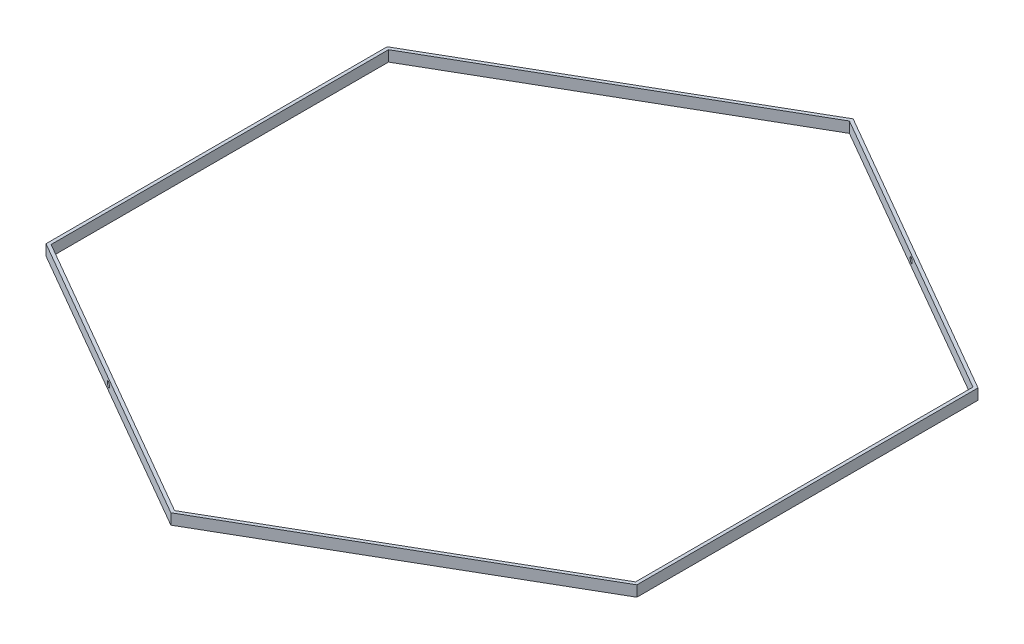
from build123d import *

# Parameters (mm, degrees)
RESSALTO_EXTRUS_O1_DEPTH = 4
ESBO_O2_R                = 1
CORTE_EXTRUS_O1_DEPTH    = 277.856160006


with BuildPart() as part:
    # Esboço1 → Ressalto-extrusão1 (new body)
    with BuildSketch(Plane(origin=(0, 0, 0), x_dir=(1, 0, 0), z_dir=(0, 1, 0))):
        Polygon((110, -63.508529611), (110, 63.508529611), (0, 127.017059222), (-110, 63.508529611), (-110, -63.508529611), (0, -127.017059222), align=None)
        Polygon((108.8, 62.815709288), (0, 125.631418576), (-108.8, 62.815709288), (-108.8, -62.815709288), (0, -125.631418576), (108.8, -62.815709288), align=None, mode=Mode.SUBTRACT)
    extrude(amount=RESSALTO_EXTRUS_O1_DEPTH)

    # Esboço2 → Corte-extrusão1 (cut, through all)
    with BuildSketch(Plane(origin=(-55, 0, 95.262794416), x_dir=(0.8660254037844387, 0, 0.49999999999999994), z_dir=(-0.4999999999999999, 0, 0.8660254037844386))):
        with Locations((0, 2)):
            Circle(ESBO_O2_R)
    extrude(amount=-CORTE_EXTRUS_O1_DEPTH, mode=Mode.SUBTRACT)


solid = part.part
